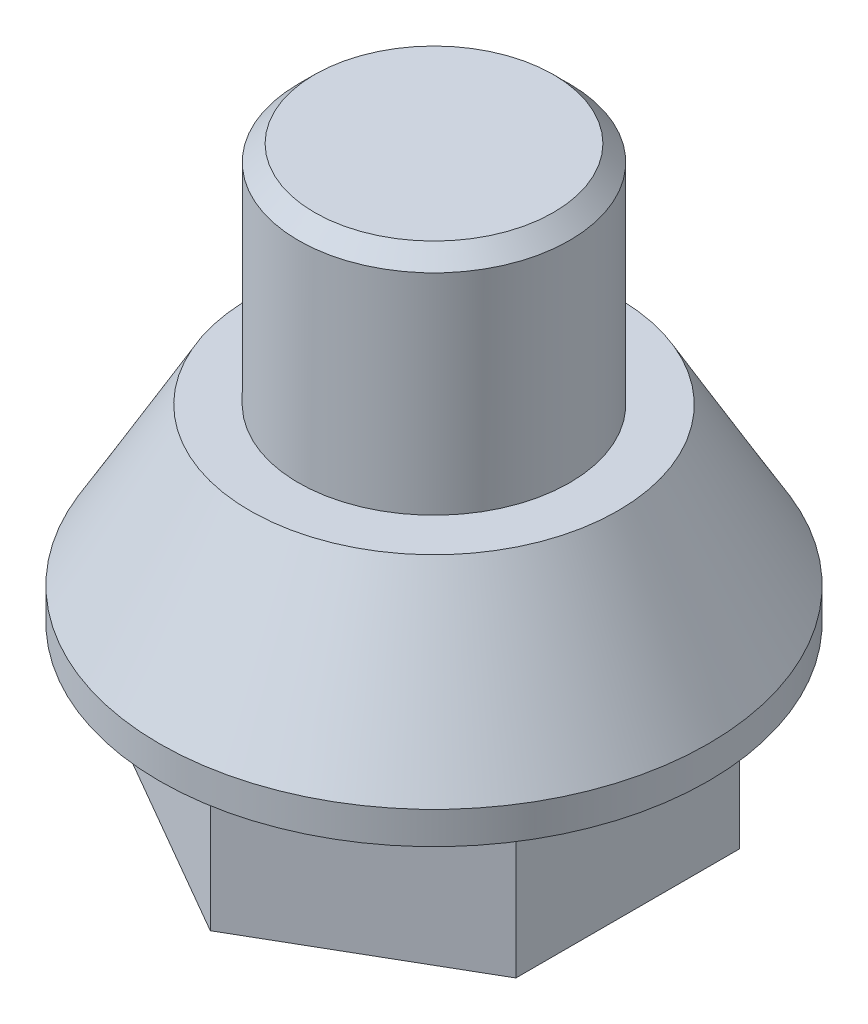
from build123d import *

# Parameters (mm, degrees)
BOSS_EXTRUDE1_DEPTH = 4.8
SKETCH2_R           = 8.5
BOSS_EXTRUDE2_DEPTH = 1
CHAMFER1_SIZE       = 0.5


with BuildPart() as part:
    # Sketch1 → Boss-Extrude1 (new body)
    with BuildSketch(Plane(origin=(0, 0, 0), x_dir=(1, 0, 0), z_dir=(0, 1, 0))):
        Polygon((0, 6.92820323), (6, 3.464101615), (6, -3.464101615), (0, -6.92820323), (-6, -3.464101615), (-6, 3.464101615), align=None)
    extrude(amount=BOSS_EXTRUDE1_DEPTH)

    # Sketch2 → Boss-Extrude2 (add)
    with BuildSketch(Plane(origin=(0, 4.8, 0), x_dir=(1, 0, 0), z_dir=(0, 1, 0))):
        with Locations(Location((0, 0, 0), (0, 0, 270))):
            Circle(SKETCH2_R)
    extrude(amount=BOSS_EXTRUDE2_DEPTH)

    # Sketch3 → Revolve1 (revolve)
    with BuildSketch(Plane.XY):
        Polygon((0, 5.8), (8.5, 5.8), (5.7, 10.649742261), (4.2, 10.649742261), (4.2, 17.649742261), (0, 17.649742261), align=None)
    revolve(axis=Axis((0, 5.8, 0), (0, 1, 0)))

    # Chamfer1
    chamfer1_edges = [part.edges().sort_by_distance(p)[0] for p in [
        (-4.2, 17.649742261, 0),
    ]]
    chamfer(chamfer1_edges, length=CHAMFER1_SIZE)


solid = part.part
